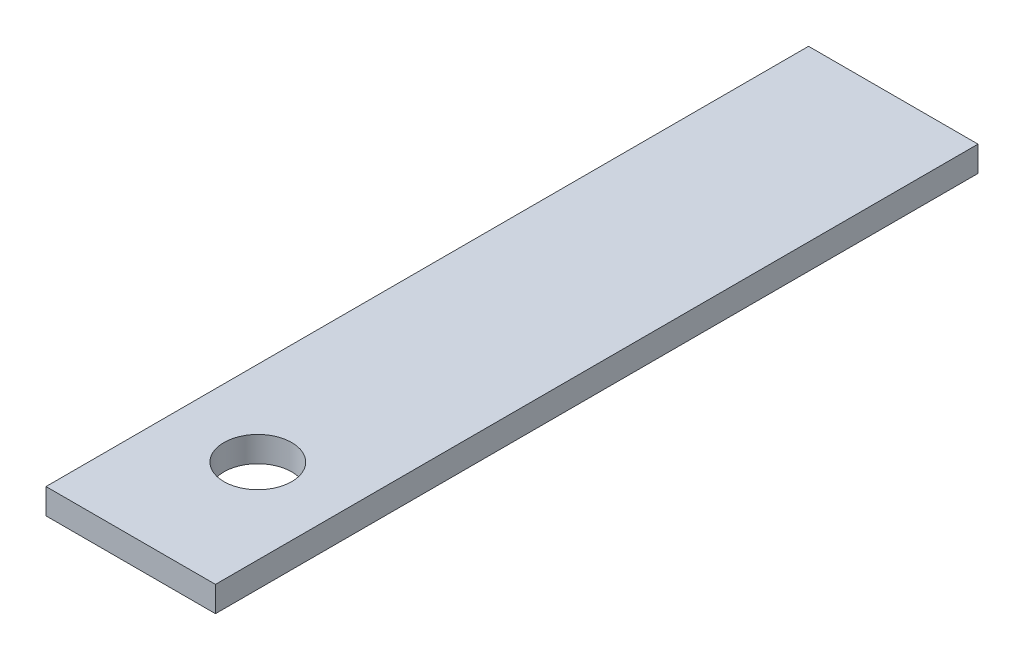
from build123d import *

# Parameters (mm, degrees)
SKETCH1_W           = 20
SKETCH1_H           = 90
SKETCH1_R           = 4
BOSS_EXTRUDE1_DEPTH = 3


with BuildPart() as part:
    # Sketch1 → Boss-Extrude1 (new body)
    with BuildSketch(Plane(origin=(0, 0, 0), x_dir=(1, 0, 0), z_dir=(0, 1, 0))):
        Rectangle(SKETCH1_W, SKETCH1_H)
        with Locations(Location((0, -30, 0), (0, 0, 270))):
            Circle(SKETCH1_R, mode=Mode.SUBTRACT)
    extrude(amount=BOSS_EXTRUDE1_DEPTH)


solid = part.part
